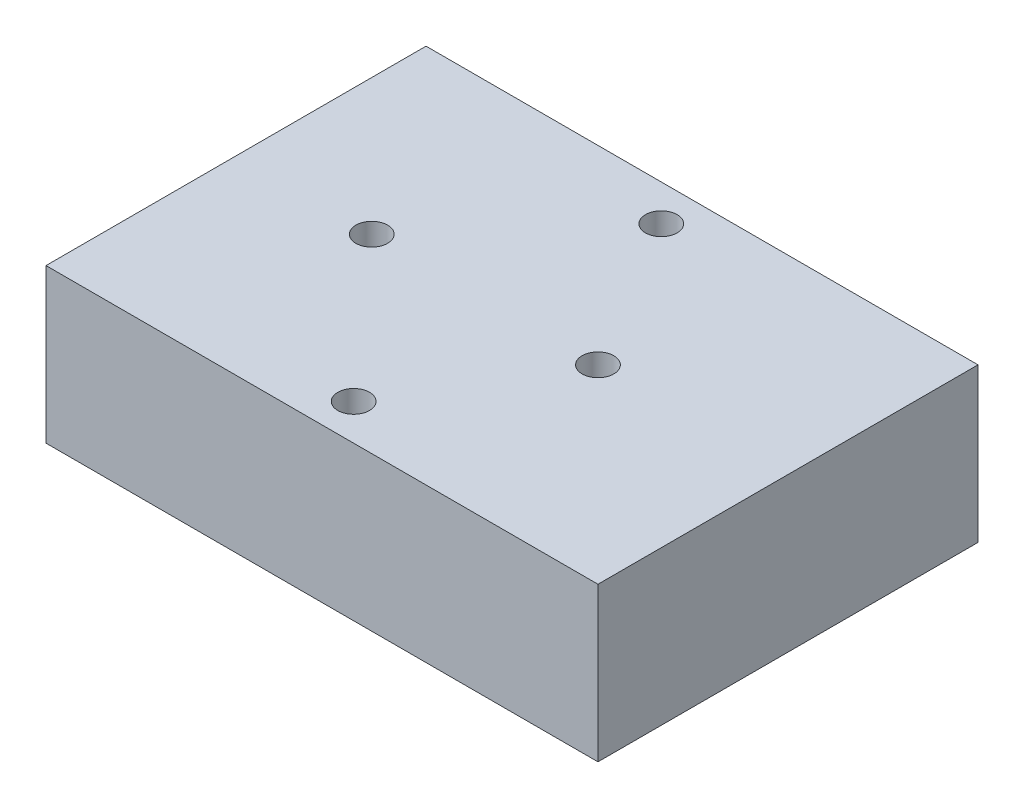
from build123d import *

# Parameters (mm, degrees)
SKETCH_1_W          = 61
SKETCH_1_H          = 42
EXTRUDE_1_DEPTH     = 17
SKETCH_2_R          = 1.75
CUT_EXTRUDE_1_DEPTH = 17
SKETCH_3_R          = 2.5
CUT_EXTRUDE_2_DEPTH = 45


with BuildPart() as part:
    # 草图1 → 凸台-拉伸1 (new body)
    with BuildSketch(Plane(origin=(0, 0, 0), x_dir=(1, 0, 0), z_dir=(0, 1, 0))):
        Rectangle(SKETCH_1_W, SKETCH_1_H)
    extrude(amount=EXTRUDE_1_DEPTH)

    # 草图2 → 切除-拉伸1 (cut)
    with BuildSketch(Plane(origin=(0, 17, 0), x_dir=(1, 0, 0), z_dir=(0, 1, 0))):
        with Locations(Location((-0.5, 17, 0), (0, 0, 270))):
            Circle(SKETCH_2_R)
        with Locations(Location((-0.5, -17, 0), (0, 0, 270))):
            Circle(SKETCH_2_R)
        with Locations(Location((-15.5, 0, 0), (0, 0, 270))):
            Circle(SKETCH_2_R)
        with Locations(Location((9.5, 0, 0), (0, 0, 270))):
            Circle(SKETCH_2_R)
    extrude(amount=-CUT_EXTRUDE_1_DEPTH, mode=Mode.SUBTRACT)

    # 草图3 → 切除-拉伸2 (cut)
    with BuildSketch(Plane.ZY.offset(30.5)):
        with Locations((-9, 8.5)):
            Circle(SKETCH_3_R)
        with Locations((9, 8.5)):
            Circle(SKETCH_3_R)
    extrude(amount=-CUT_EXTRUDE_2_DEPTH, mode=Mode.SUBTRACT)


solid = part.part
